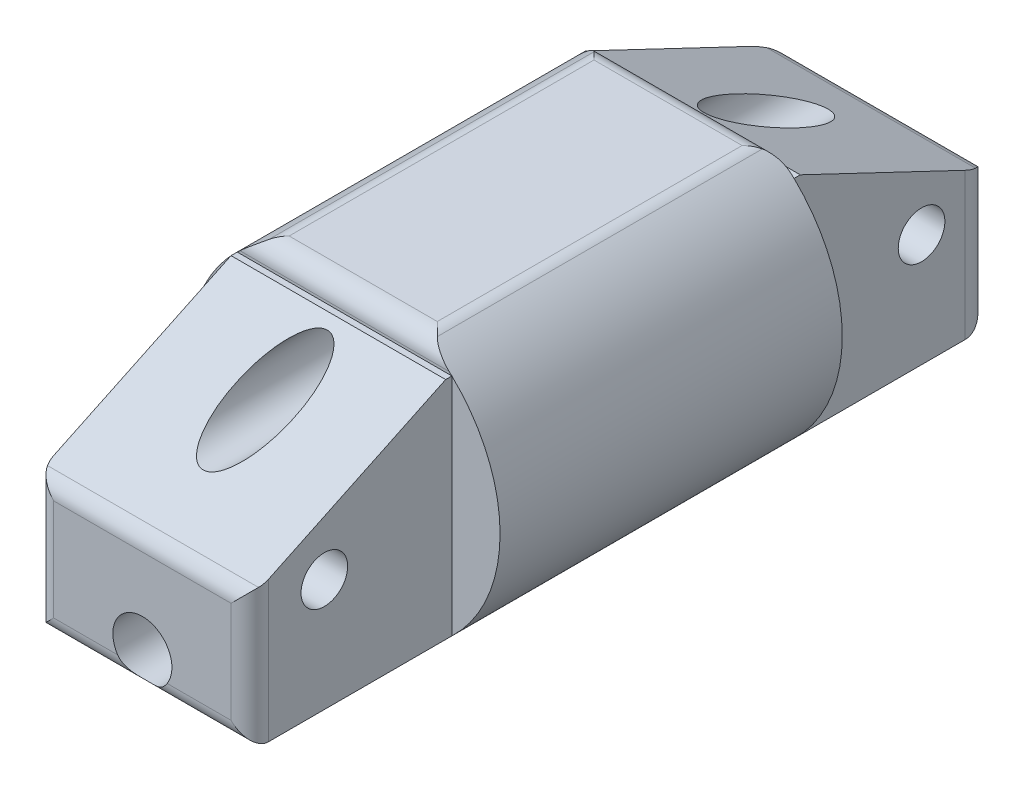
from build123d import *

# Parameters (mm, degrees)
SKETCH1_R               = 12.7
FINGERBODY_DEPTH        = 27.94
SKETCH2_W               = 17.526
SKETCH2_H               = 18.384757926
BOSS_EXTRUDE2_DEPTH     = 16.51
SKETCH4_R               = 1.905
CUT_EXTRUDE2_DEPTH      = 51.96815544
CUT_EXTRUDE3_DEPTH      = 51.96815544
FILLET2_R               = 2.54
CUT_EXTRUDE5_DEPTH      = 48.941448664
FILLET3_R               = 1.524
FILLET4_R               = 1.524
FILLET6_R               = 1.524
CUT_EXTRUDE6_DEPTH      = 48.50139565
CUT_EXTRUDE6_DEPTH_BACK = 48.50139565
SKETCH11_R              = 2.413


with BuildPart() as part:
    # Sketch1 → FingerBody (new body)
    with BuildSketch(Plane.XY):
        Circle(SKETCH1_R)
    extrude(amount=FINGERBODY_DEPTH)

    # Sketch2 → Boss-Extrude2 (add)
    with BuildSketch(Plane(origin=(0, 0, 0), x_dir=(-1, 0, 0), z_dir=(0, 0, -1))):
        Rectangle(SKETCH2_W, SKETCH2_H)
    boss_extrude2 = extrude(amount=BOSS_EXTRUDE2_DEPTH)

    # Mirror1: Boss-Extrude2 across plane
    add(boss_extrude2.mirror(Plane(origin=(0, 0, 13.97), x_dir=(1, 0, 0), z_dir=(0, 0, -1))))

    # Sketch4 → Cut-Extrude2 (cut, through all)
    with BuildSketch(Plane.ZY.offset(8.763)):
        with Locations(Location((38.354, 0, 0), (0, 0, 270))):
            Circle(SKETCH4_R)
    cut_extrude2 = extrude(amount=-CUT_EXTRUDE2_DEPTH, mode=Mode.SUBTRACT)

    # Mirror2: Cut-Extrude2 across plane
    add(cut_extrude2.mirror(Plane(origin=(0, 0, 13.97), x_dir=(1, 0, 0), z_dir=(0, 0, -1))), mode=Mode.SUBTRACT)

    # Sketch5 → Cut-Extrude3 (cut, through all)
    with BuildSketch(Plane(origin=(8.763, 0, 0), x_dir=(0, 0, -1), z_dir=(1, 0, 0))):
        Polygon((16.51, 1.572378963), (0.508, 9.192378963), (16.51, 9.192378963), align=None)
    cut_extrude3 = extrude(amount=-CUT_EXTRUDE3_DEPTH, mode=Mode.SUBTRACT)

    # Fillet2
    fillet2_edges = [part.edges().sort_by_distance(p)[0] for p in [
        (0, -9.192378963, -16.51),
        (8.763, -3.81, -16.51),
        (0, 1.572378963, -16.51),
        (-8.763, -3.81, -16.51),
    ]]
    fillet(fillet2_edges, radius=FILLET2_R)

    # Mirror6: Cut-Extrude3 across plane
    add(cut_extrude3.mirror(Plane(origin=(0, 0, 13.97), x_dir=(1, 0, 0), z_dir=(0, 0, -1))), mode=Mode.SUBTRACT)

    # Sketch8 → Cut-Extrude5 (cut, symmetric)
    with BuildSketch(Plane(origin=(0, 0, 0), x_dir=(-1, 0, 0), z_dir=(0, 0, -1))):
        with BuildLine():
            Line((6.480734218, 10.922), (-6.480734218, 10.922))
            ThreePointArc((-6.480734218, 10.922), (0, 12.7), (6.480734218, 10.922))
        make_face()
    cut_extrude5 = extrude(amount=CUT_EXTRUDE5_DEPTH, both=True, mode=Mode.SUBTRACT)

    # Mirror7: Cut-Extrude5 across plane
    add(cut_extrude5.mirror(Plane(origin=(0, 0, 0), x_dir=(0, 0, 1), z_dir=(0, -1, 0))), mode=Mode.SUBTRACT)

    # Fillet3
    fillet3_edges = [part.edges().sort_by_distance(p)[0] for p in [
        (6.480734218, 10.922, 13.97),
        (-6.480734218, 10.922, 13.97),
        (0, 10.922, 27.94),
        (0, 10.922, 0),
    ]]
    fillet(fillet3_edges, radius=FILLET3_R)

    # Fillet4
    fillet4_edges = [part.edges().sort_by_distance(p)[0] for p in [
        (6.480734218, -10.922, 13.97),
        (-6.480734218, -10.922, 13.97),
        (0, -10.922, 27.94),
        (0, -10.922, 0),
    ]]
    fillet(fillet4_edges, radius=FILLET4_R)

    # Fillet6
    fillet6_edges = [part.edges().sort_by_distance(p)[0] for p in [
        (-8.763, -3.81, 44.45),
        (0, -9.192378963, 44.45),
        (8.763, -3.81, 44.45),
        (0, 1.572378963, 44.45),
    ]]
    fillet(fillet6_edges, radius=FILLET6_R)

    # Sketch11 → Cut-Extrude6 (cut, two sides: drawn at the far end of the back side and taken through both)
    with BuildSketch(Plane.XY.offset(27.94).offset(-CUT_EXTRUDE6_DEPTH_BACK)):
        with Locations(Location((0, 6.35, 0), (0, 0, 270))):
            Circle(SKETCH11_R)
        with Locations(Location((0, -6.35, 0), (0, 0, 352.801199766))):
            Circle(SKETCH11_R)
    extrude(amount=CUT_EXTRUDE6_DEPTH + CUT_EXTRUDE6_DEPTH_BACK, mode=Mode.SUBTRACT)


solid = part.part
